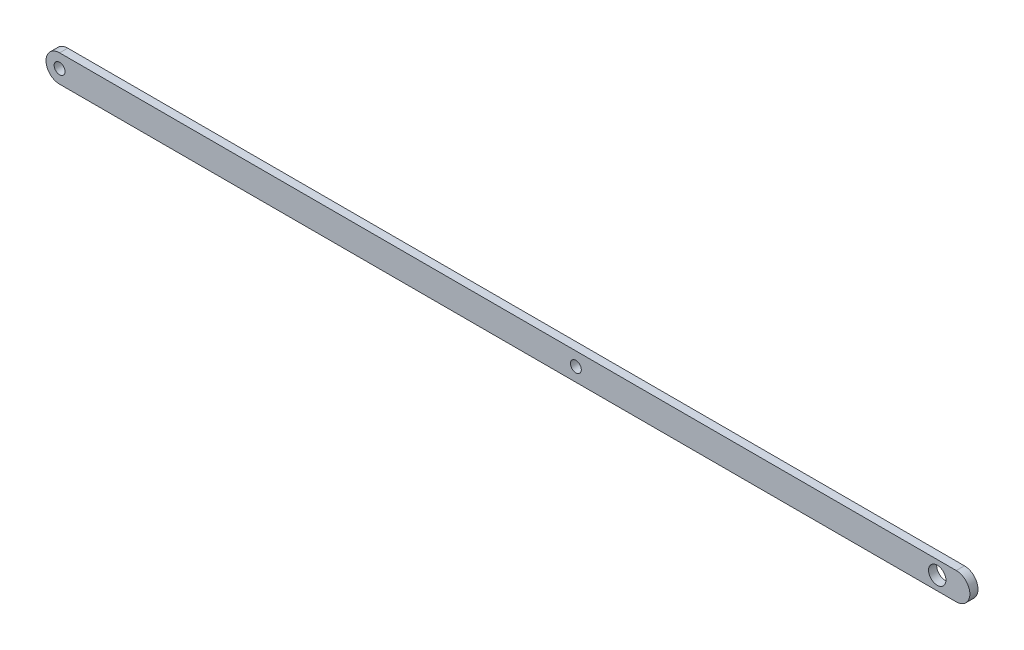
from build123d import *

# Parameters (mm, degrees)
BOSS_EXTRUDE1_DEPTH = 3
SKETCH2_R           = 3.2
CUT_EXTRUDE1_DEPTH  = 3
SKETCH5_R           = 2
CUT_EXTRUDE2_DEPTH  = 3
SKETCH10_R          = 2
CUT_EXTRUDE4_DEPTH  = 3


with BuildPart() as part:
    # Sketch1 → Boss-Extrude1 (new body)
    with BuildSketch(Plane.XY):
        with BuildLine():
            Line((0, 5), (330, 5))
            ThreePointArc((330, 5), (335, 0), (330, -5))
            Line((330, -5), (0, -5))
            ThreePointArc((0, -5), (-5, 0), (0, 5))
        make_face()
    extrude(amount=BOSS_EXTRUDE1_DEPTH)

    # Sketch2 → Cut-Extrude1 (cut)
    with BuildSketch(Plane.XY.offset(3)):
        with Locations((323, 0)):
            Circle(SKETCH2_R)
    extrude(amount=-CUT_EXTRUDE1_DEPTH, mode=Mode.SUBTRACT)

    # Sketch5 → Cut-Extrude2 (cut)
    with BuildSketch(Plane.XY.offset(3)):
        with Locations((190, 0)):
            Circle(SKETCH5_R)
    extrude(amount=-CUT_EXTRUDE2_DEPTH, mode=Mode.SUBTRACT)

    # Sketch10 → Cut-Extrude4 (cut)
    with BuildSketch(Plane.XY.offset(3)):
        Circle(SKETCH10_R)
    extrude(amount=-CUT_EXTRUDE4_DEPTH, mode=Mode.SUBTRACT)


solid = part.part
